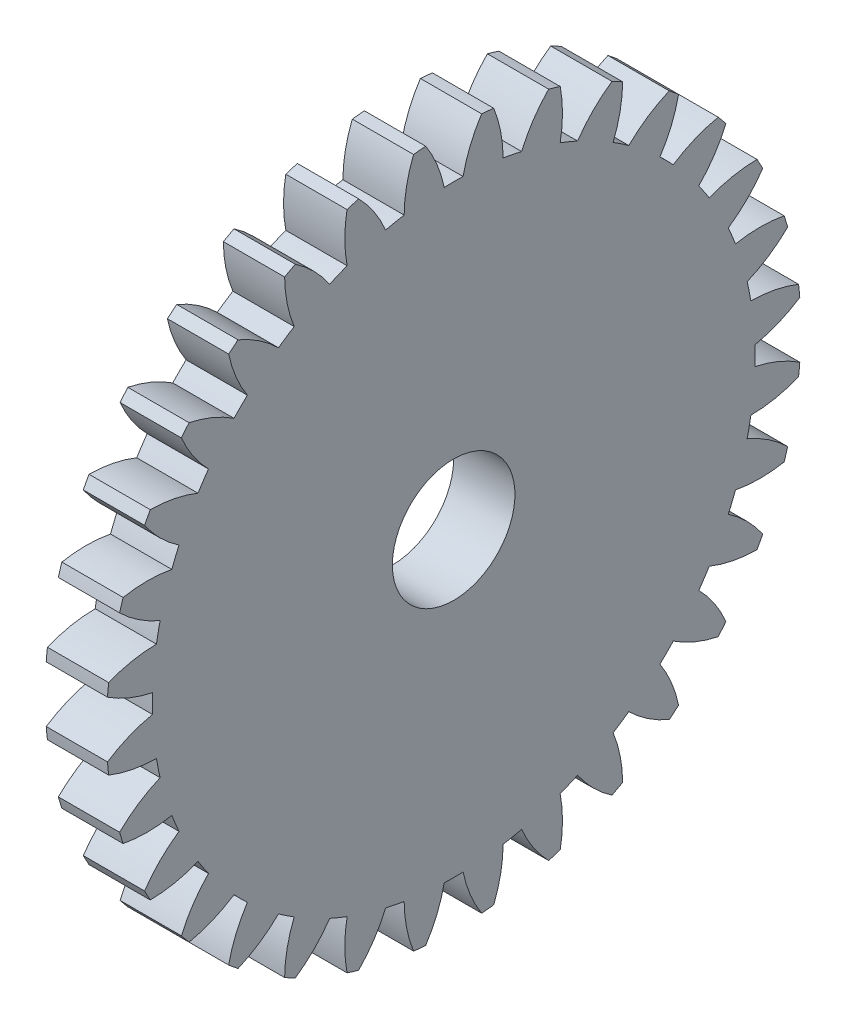
from build123d import *

# Parameters (mm, degrees)
BASPROSKE_W     = 3
BASPROSKE_H     = 17
TOOTHCUT_DEPTH  = 25.228082879
TEETHCUTS_COUNT = 32
TEETHCUTS_ANGLE = 348.75
BORSKE_R        = 3
BORE_DEPTH      = 50.0000508


with BuildPart() as part:
    # BasProSke → Base-Revolve (revolve)
    with BuildSketch(Plane(origin=(0, 0, 0), x_dir=(1, 0, 0), z_dir=(0, 1, 0)), mode=Mode.PRIVATE) as base_revolve_sk:
        with Locations((1.5, 8.5)):
            Rectangle(BASPROSKE_W, BASPROSKE_H)
    revolve(base_revolve_sk.sketch.rotate(Axis((-10, 0, 0), (1, 0, 0)), 180), axis=Axis((-10, 0, 0), (1, 0, 0)))

    # TooCutSke → ToothCut (cut, through all)
    with BuildSketch(Plane(origin=(0, 0, 0), x_dir=(0, 0, -1), z_dir=(1, 0, 0))):
        with BuildLine():
            ThreePointArc((0.462036907, 14.741761187), (0, 14.749), (-0.462036907, 14.741761187))
            ThreePointArc((-0.462036907, 14.741761187), (-0.81854142, 15.899240468), (-1.386721275, 16.9688317))
            ThreePointArc((-1.386721275, 16.9688317), (0, 17.0254), (1.386721275, 16.9688317))
            ThreePointArc((1.386721275, 16.9688317), (0.81854142, 15.899240468), (0.462036907, 14.741761187))
        make_face()
    toothcut = extrude(amount=TOOTHCUT_DEPTH, mode=Mode.SUBTRACT)

    # TeethCuts: ToothCut ×32 about axis
    teethcuts_axis = Axis((-10, 0, 0), (1, 0, 0))
    for i in range(1, TEETHCUTS_COUNT):
        add(toothcut.rotate(teethcuts_axis, i * TEETHCUTS_ANGLE / (TEETHCUTS_COUNT - 1)), mode=Mode.SUBTRACT)

    # BorSke → Bore (cut, symmetric)
    with BuildSketch(Plane(origin=(0, 0, 0), x_dir=(0, 0, -1), z_dir=(1, 0, 0))):
        with Locations(Location((0, 0, 0), (0, 0, 180))):
            Circle(BORSKE_R)
    extrude(amount=BORE_DEPTH, both=True, mode=Mode.SUBTRACT)


solid = part.part
